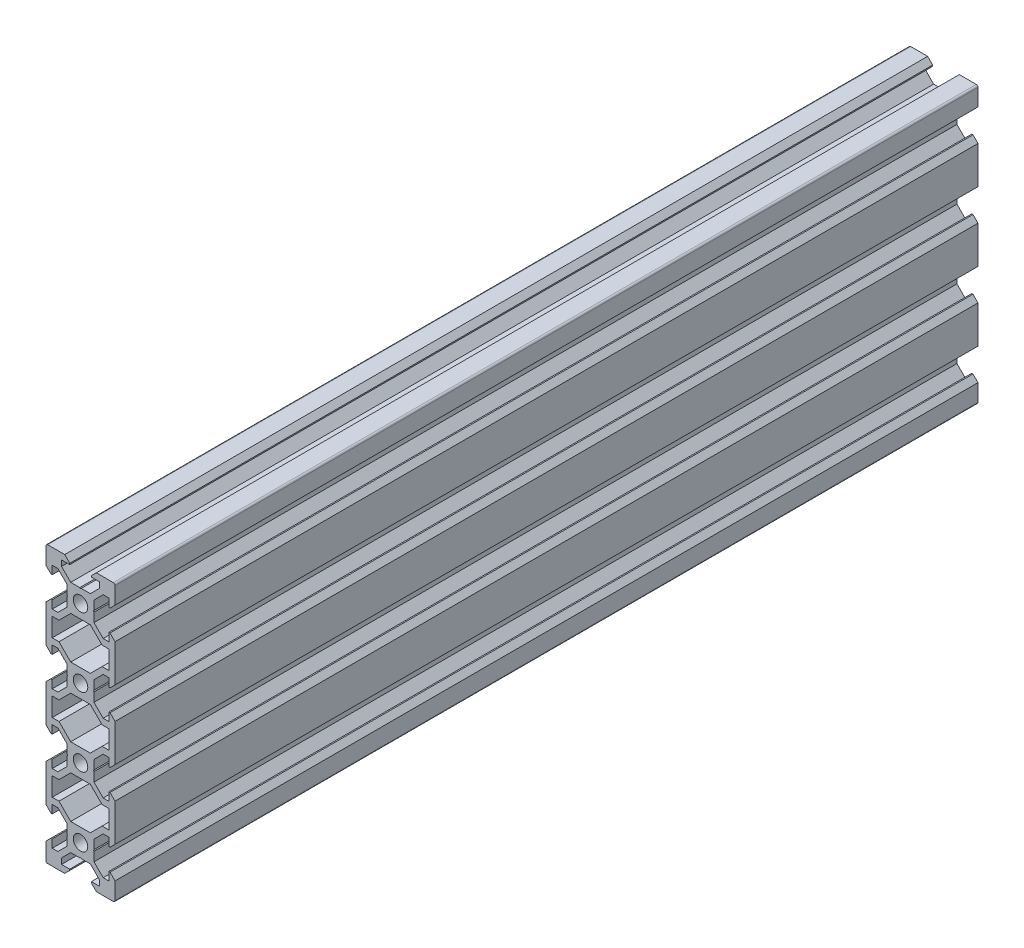
from build123d import *

# Parameters (mm, degrees)
SKETCH1_R           = 2.1
BOSS_EXTRUDE1_DEPTH = 250


with BuildPart() as part:
    # Sketch1 → Boss-Extrude1 (new body)
    with BuildSketch(Plane.XY):
        with BuildLine():
            Line((4.58, -40), (9.5, -40))
            ThreePointArc((9.5, -40), (9.853553391, -39.853553391), (10, -39.5))
            Line((10, -39.5), (10, -34.58))
            Line((10, -34.58), (8.545, -33.125))
            Line((8.545, -33.125), (8.2, -33.125))
            Line((8.2, -33.125), (8.2, -35.5))
            Line((8.2, -35.5), (6.560660172, -35.5))
            Line((6.560660172, -35.5), (3.9, -32.839339828))
            Line((3.9, -32.839339828), (3.9, -30.21))
            Line((3.9, -30.21), (3.69, -30))
            Line((3.69, -30), (3.9, -29.79))
            Line((3.9, -29.79), (3.9, -27.160660172))
            Line((3.9, -27.160660172), (6.560660172, -24.5))
            Line((6.560660172, -24.5), (8.2, -24.5))
            Line((8.2, -24.5), (8.2, -26.875))
            Line((8.2, -26.875), (8.545, -26.875))
            Line((8.545, -26.875), (10, -25.42))
            Line((10, -25.42), (10, -14.58))
            Line((10, -14.58), (8.545, -13.125))
            Line((8.545, -13.125), (8.2, -13.125))
            Line((8.2, -13.125), (8.2, -15.5))
            Line((8.2, -15.5), (6.560660172, -15.5))
            Line((6.560660172, -15.5), (3.9, -12.839339828))
            Line((3.9, -12.839339828), (3.9, -10.21))
            Line((3.9, -10.21), (3.69, -10))
            Line((3.69, -10), (3.9, -9.79))
            Line((3.9, -9.79), (3.9, -7.160660172))
            Line((3.9, -7.160660172), (6.560660172, -4.5))
            Line((6.560660172, -4.5), (8.2, -4.5))
            Line((8.2, -4.5), (8.2, -6.875))
            Line((8.2, -6.875), (8.545, -6.875))
            Line((8.545, -6.875), (10, -5.42))
            Line((10, -5.42), (10, 5.42))
            Line((10, 5.42), (8.545, 6.875))
            Line((8.545, 6.875), (8.2, 6.875))
            Line((8.2, 6.875), (8.2, 4.5))
            Line((8.2, 4.5), (6.560660172, 4.5))
            Line((6.560660172, 4.5), (3.9, 7.160660172))
            Line((3.9, 7.160660172), (3.9, 9.79))
            Line((3.9, 9.79), (3.69, 10))
            Line((3.69, 10), (3.9, 10.21))
            Line((3.9, 10.21), (3.9, 12.839339828))
            Line((3.9, 12.839339828), (6.560660172, 15.5))
            Line((6.560660172, 15.5), (8.2, 15.5))
            Line((8.2, 15.5), (8.2, 13.125))
            Line((8.2, 13.125), (8.545, 13.125))
            Line((8.545, 13.125), (10, 14.58))
            Line((10, 14.58), (10, 25.42))
            Line((10, 25.42), (8.545, 26.875))
            Line((8.545, 26.875), (8.2, 26.875))
            Line((8.2, 26.875), (8.2, 24.5))
            Line((8.2, 24.5), (6.560660172, 24.5))
            Line((6.560660172, 24.5), (3.9, 27.160660172))
            Line((3.9, 27.160660172), (3.9, 29.79))
            Line((3.9, 29.79), (3.69, 30))
            Line((3.69, 30), (3.9, 30.21))
            Line((3.9, 30.21), (3.9, 32.839339828))
            Line((3.9, 32.839339828), (6.560660172, 35.5))
            Line((6.560660172, 35.5), (8.2, 35.5))
            Line((8.2, 35.5), (8.2, 33.125))
            Line((8.2, 33.125), (8.545, 33.125))
            Line((8.545, 33.125), (10, 34.58))
            Line((10, 34.58), (10, 39.5))
            ThreePointArc((10, 39.5), (9.853553391, 39.853553391), (9.5, 40))
            Line((9.5, 40), (4.58, 40))
            Line((4.58, 40), (3.125, 38.545))
            Line((3.125, 38.545), (3.125, 38.2))
            Line((3.125, 38.2), (5.5, 38.2))
            Line((5.5, 38.2), (5.5, 36.560660172))
            Line((5.5, 36.560660172), (2.839339828, 33.9))
            Line((2.839339828, 33.9), (0.21, 33.9))
            Line((0.21, 33.9), (0, 33.69))
            Line((0, 33.69), (-0.21, 33.9))
            Line((-0.21, 33.9), (-2.839339828, 33.9))
            Line((-2.839339828, 33.9), (-5.5, 36.560660172))
            Line((-5.5, 36.560660172), (-5.5, 38.2))
            Line((-5.5, 38.2), (-3.125, 38.2))
            Line((-3.125, 38.2), (-3.125, 38.545))
            Line((-3.125, 38.545), (-4.58, 40))
            Line((-4.58, 40), (-9.5, 40))
            ThreePointArc((-9.5, 40), (-9.853553391, 39.853553391), (-10, 39.5))
            Line((-10, 39.5), (-10, 34.58))
            Line((-10, 34.58), (-8.545, 33.125))
            Line((-8.545, 33.125), (-8.2, 33.125))
            Line((-8.2, 33.125), (-8.2, 35.5))
            Line((-8.2, 35.5), (-6.560660172, 35.5))
            Line((-6.560660172, 35.5), (-3.9, 32.839339828))
            Line((-3.9, 32.839339828), (-3.9, 30.21))
            Line((-3.9, 30.21), (-3.69, 30))
            Line((-3.69, 30), (-3.9, 29.79))
            Line((-3.9, 29.79), (-3.9, 27.160660172))
            Line((-3.9, 27.160660172), (-6.560660172, 24.5))
            Line((-6.560660172, 24.5), (-8.2, 24.5))
            Line((-8.2, 24.5), (-8.2, 26.875))
            Line((-8.2, 26.875), (-8.545, 26.875))
            Line((-8.545, 26.875), (-10, 25.42))
            Line((-10, 25.42), (-10, 14.58))
            Line((-10, 14.58), (-8.545, 13.125))
            Line((-8.545, 13.125), (-8.2, 13.125))
            Line((-8.2, 13.125), (-8.2, 15.5))
            Line((-8.2, 15.5), (-6.560660172, 15.5))
            Line((-6.560660172, 15.5), (-3.9, 12.839339828))
            Line((-3.9, 12.839339828), (-3.9, 10.21))
            Line((-3.9, 10.21), (-3.69, 10))
            Line((-3.69, 10), (-3.9, 9.79))
            Line((-3.9, 9.79), (-3.9, 7.160660172))
            Line((-3.9, 7.160660172), (-6.560660172, 4.5))
            Line((-6.560660172, 4.5), (-8.2, 4.5))
            Line((-8.2, 4.5), (-8.2, 6.875))
            Line((-8.2, 6.875), (-8.545, 6.875))
            Line((-8.545, 6.875), (-10, 5.42))
            Line((-10, 5.42), (-10, -5.42))
            Line((-10, -5.42), (-8.545, -6.875))
            Line((-8.545, -6.875), (-8.2, -6.875))
            Line((-8.2, -6.875), (-8.2, -4.5))
            Line((-8.2, -4.5), (-6.560660172, -4.5))
            Line((-6.560660172, -4.5), (-3.9, -7.160660172))
            Line((-3.9, -7.160660172), (-3.9, -9.79))
            Line((-3.9, -9.79), (-3.69, -10))
            Line((-3.69, -10), (-3.9, -10.21))
            Line((-3.9, -10.21), (-3.9, -12.839339828))
            Line((-3.9, -12.839339828), (-6.560660172, -15.5))
            Line((-6.560660172, -15.5), (-8.2, -15.5))
            Line((-8.2, -15.5), (-8.2, -13.125))
            Line((-8.2, -13.125), (-8.545, -13.125))
            Line((-8.545, -13.125), (-10, -14.58))
            Line((-10, -14.58), (-10, -25.42))
            Line((-10, -25.42), (-8.545, -26.875))
            Line((-8.545, -26.875), (-8.2, -26.875))
            Line((-8.2, -26.875), (-8.2, -24.5))
            Line((-8.2, -24.5), (-6.560660172, -24.5))
            Line((-6.560660172, -24.5), (-3.9, -27.160660172))
            Line((-3.9, -27.160660172), (-3.9, -29.79))
            Line((-3.9, -29.79), (-3.69, -30))
            Line((-3.69, -30), (-3.9, -30.21))
            Line((-3.9, -30.21), (-3.9, -32.839339828))
            Line((-3.9, -32.839339828), (-6.560660172, -35.5))
            Line((-6.560660172, -35.5), (-8.2, -35.5))
            Line((-8.2, -35.5), (-8.2, -33.125))
            Line((-8.2, -33.125), (-8.545, -33.125))
            Line((-8.545, -33.125), (-10, -34.58))
            Line((-10, -34.58), (-10, -39.5))
            ThreePointArc((-10, -39.5), (-9.853553391, -39.853553391), (-9.5, -40))
            Line((-9.5, -40), (-4.58, -40))
            Line((-4.58, -40), (-3.125, -38.545))
            Line((-3.125, -38.545), (-3.125, -38.2))
            Line((-3.125, -38.2), (-5.5, -38.2))
            Line((-5.5, -38.2), (-5.5, -36.560660172))
            Line((-5.5, -36.560660172), (-2.839339828, -33.9))
            Line((-2.839339828, -33.9), (-0.21, -33.9))
            Line((-0.21, -33.9), (0, -33.69))
            Line((0, -33.69), (0.21, -33.9))
            Line((0.21, -33.9), (2.839339828, -33.9))
            Line((2.839339828, -33.9), (5.5, -36.560660172))
            Line((5.5, -36.560660172), (5.5, -38.2))
            Line((5.5, -38.2), (3.125, -38.2))
            Line((3.125, -38.2), (3.125, -38.545))
            Line((3.125, -38.545), (4.58, -40))
        make_face()
        with Locations((0, -30)):
            Circle(SKETCH1_R, mode=Mode.SUBTRACT)
        Polygon((-6.239339828, -22.7), (-8.2, -22.7), (-8.2, -17.3), (-6.239339828, -17.3), (-2.839339828, -13.9), (2.839339828, -13.9), (6.239339828, -17.3), (8.2, -17.3), (8.2, -22.7), (6.239339828, -22.7), (2.839339828, -26.1), (-2.839339828, -26.1), align=None, mode=Mode.SUBTRACT)
        with Locations((0, -10)):
            Circle(SKETCH1_R, mode=Mode.SUBTRACT)
        Polygon((-6.239339828, -2.7), (-8.2, -2.7), (-8.2, 2.7), (-6.239339828, 2.7), (-2.839339828, 6.1), (2.839339828, 6.1), (6.239339828, 2.7), (8.2, 2.7), (8.2, -2.7), (6.239339828, -2.7), (2.839339828, -6.1), (-2.839339828, -6.1), align=None, mode=Mode.SUBTRACT)
        with Locations((0, 10)):
            Circle(SKETCH1_R, mode=Mode.SUBTRACT)
        Polygon((-6.239339828, 17.3), (-8.2, 17.3), (-8.2, 22.7), (-6.239339828, 22.7), (-2.839339828, 26.1), (2.839339828, 26.1), (6.239339828, 22.7), (8.2, 22.7), (8.2, 17.3), (6.239339828, 17.3), (2.839339828, 13.9), (-2.839339828, 13.9), align=None, mode=Mode.SUBTRACT)
        with Locations((0, 30)):
            Circle(SKETCH1_R, mode=Mode.SUBTRACT)
    extrude(amount=BOSS_EXTRUDE1_DEPTH)


solid = part.part
